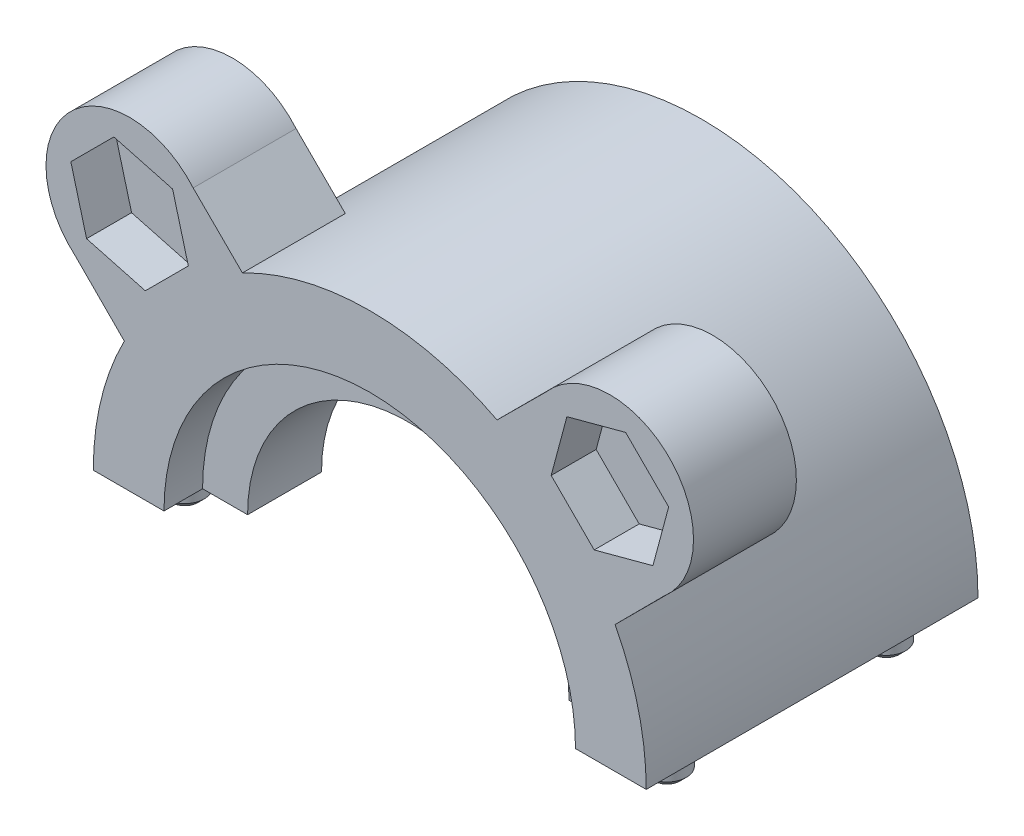
from build123d import *

# Parameters (mm, degrees)
SKETCH2_W               = 113.16294167
SKETCH2_H               = 44.385347151
CUT_EXTRUDE1_DEPTH      = 40.876559531
BOSS_EXTRUDE1_START     = -8
BOSS_EXTRUDE1_DEPTH     = 8
CORTAR_EXTRUIR1_DEPTH   = 3.5
SKETCH4_R               = 1.5
SALIENTE_EXTRUIR1_DEPTH = 2.5
CHAFL_N5_SIZE           = 0.5
SCALE1_SCALE            = 2.1714285


with BuildPart() as part:
    # Sketch1 → Revolve1 (revolve)
    with BuildSketch(Plane(origin=(0, 0, 0), x_dir=(1, 0, 0), z_dir=(0, 1, 0))):
        Polygon((21.5, 12.9), (16, 12.9), (16, 9.9), (12.5, 9.9), (12.5, 4.15), (17.55, 4.15), (17.55, -4.15), (12.5, -4.15), (12.5, -9.9), (16, -9.9), (16, -12.9), (21.5, -12.9), align=None)
    revolve(axis=Axis((0, 0, 0), (0, 0, -1)))

    # Sketch2 → Cut-Extrude1 (cut, through all)
    with BuildSketch(Plane(origin=(0, 0, -12.9), x_dir=(-1, 0, 0), z_dir=(0, 0, -1))):
        with Locations((0, -22.192673576)):
            Rectangle(SKETCH2_W, SKETCH2_H)
    extrude(amount=-CUT_EXTRUDE1_DEPTH, mode=Mode.SUBTRACT)

    # Sketch3 → Boss-Extrude1 (add)
    with BuildSketch(Plane.XY.offset(12.9).offset(BOSS_EXTRUDE1_START)):
        with BuildLine():
            ThreePointArc((9.901123545, 19.084489842), (15.202795796, 15.202795796), (19.084489842, 9.901123545))
            Line((19.084489842, 9.901123545), (22.894785555, 13.731141284))
            ThreePointArc((22.894785555, 13.731141284), (23.272346041, 23.272346041), (13.731141284, 22.894785555))
            Line((13.731141284, 22.894785555), (9.901123545, 19.084489842))
        make_face()
        with BuildLine():
            Line((-9.901123545, 19.084489842), (-13.731141284, 22.894785555))
            ThreePointArc((-13.731141284, 22.894785555), (-23.272346041, 23.272346041), (-22.894785555, 13.731141284))
            Line((-22.894785555, 13.731141284), (-19.084489842, 9.901123545))
            ThreePointArc((-19.084489842, 9.901123545), (-15.202795796, 15.202795796), (-9.901123545, 19.084489842))
        make_face()
    extrude(amount=BOSS_EXTRUDE1_DEPTH)

    # Croquis6 → Cortar-Extruir1 (cut)
    with BuildSketch(Plane.XY.offset(12.9)):
        Polygon((-15.331536888, 22.020767038), (-14.107322805, 17.45193788), (-17.45193788, 14.107322805), (-22.020767038, 15.331536888), (-23.244981122, 19.900366047), (-19.900366047, 23.244981122), align=None)
        Polygon((15.331536888, 22.020767038), (19.90036573, 23.244982303), (23.24497994, 19.900366363), (22.020767038, 15.331536888), (17.451938197, 14.107321624), (14.107323987, 17.451937564), align=None)
    extrude(amount=-CORTAR_EXTRUIR1_DEPTH, mode=Mode.SUBTRACT)

    # Sketch4 → Saliente-Extruir1 (add)
    with BuildSketch(Plane.XZ):
        with Locations(Location((-18.75, 8.525, 0), (0, 0, 90))):
            Circle(SKETCH4_R)
        with Locations(Location((18.75, -8.525, 0), (0, 0, 90))):
            Circle(SKETCH4_R)
        with Locations(Location((18.75, 8.525, 0), (0, 0, 90))):
            Circle(SKETCH4_R)
        with Locations(Location((-18.75, -8.525, 0), (0, 0, 90))):
            Circle(SKETCH4_R)
    extrude(amount=SALIENTE_EXTRUIR1_DEPTH)

    # Chaflán5
    chafl_n5_edges = [part.edges().sort_by_distance(p)[0] for p in [
        (-18.75, -2.5, 7.025),
        (18.75, -2.5, 7.025),
        (18.75, -2.5, -10.025),
        (-18.75, -2.5, -10.025),
    ]]
    chamfer(chafl_n5_edges, length=CHAFL_N5_SIZE)


with BuildPart() as part_1:
    # Scale1: scaled about (0, 12.592522151, 1.292940279)
    add(part.part.scale(SCALE1_SCALE).moved(Location((0, -14.751239335, -1.514587092))))


solid = part_1.part
